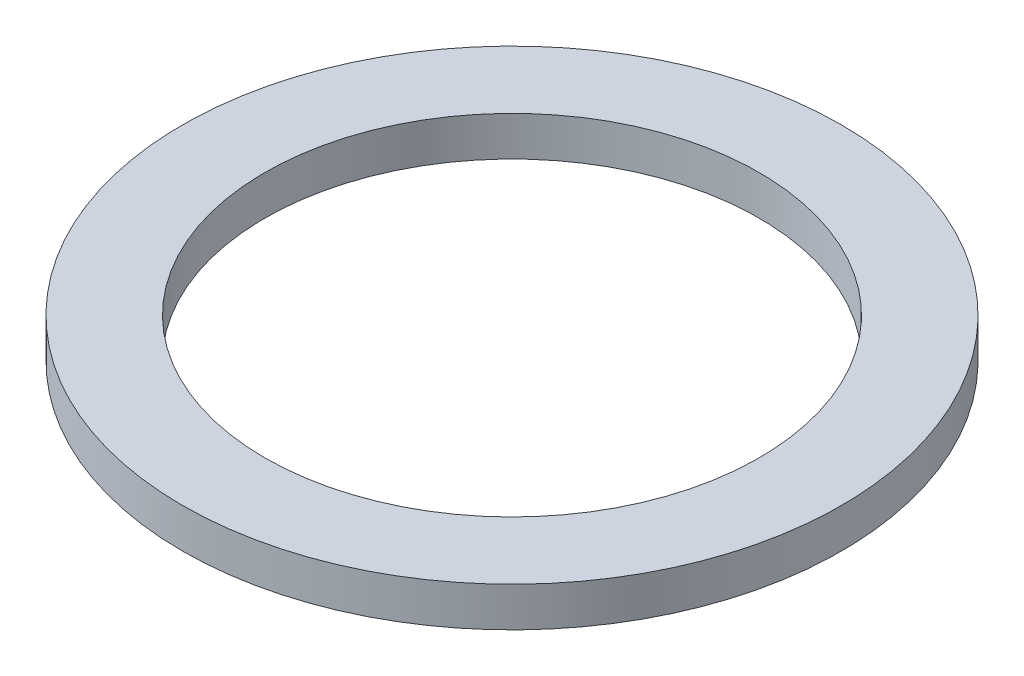
from build123d import *

# Parameters (mm, degrees)
SKETCH1_R           = 10
SKETCH1_R_2         = 7.5
BOSS_EXTRUDE1_DEPTH = 1.2


with BuildPart() as part:
    # Sketch1 → Boss-Extrude1 (new body)
    with BuildSketch(Plane(origin=(0, 0, 0), x_dir=(1, 0, 0), z_dir=(0, 1, 0))):
        with Locations(Location((0, 0, 0), (0, 0, 270))):
            Circle(SKETCH1_R)
        with Locations(Location((0, 0, 0), (0, 0, 270))):
            Circle(SKETCH1_R_2, mode=Mode.SUBTRACT)
    extrude(amount=BOSS_EXTRUDE1_DEPTH)


solid = part.part
